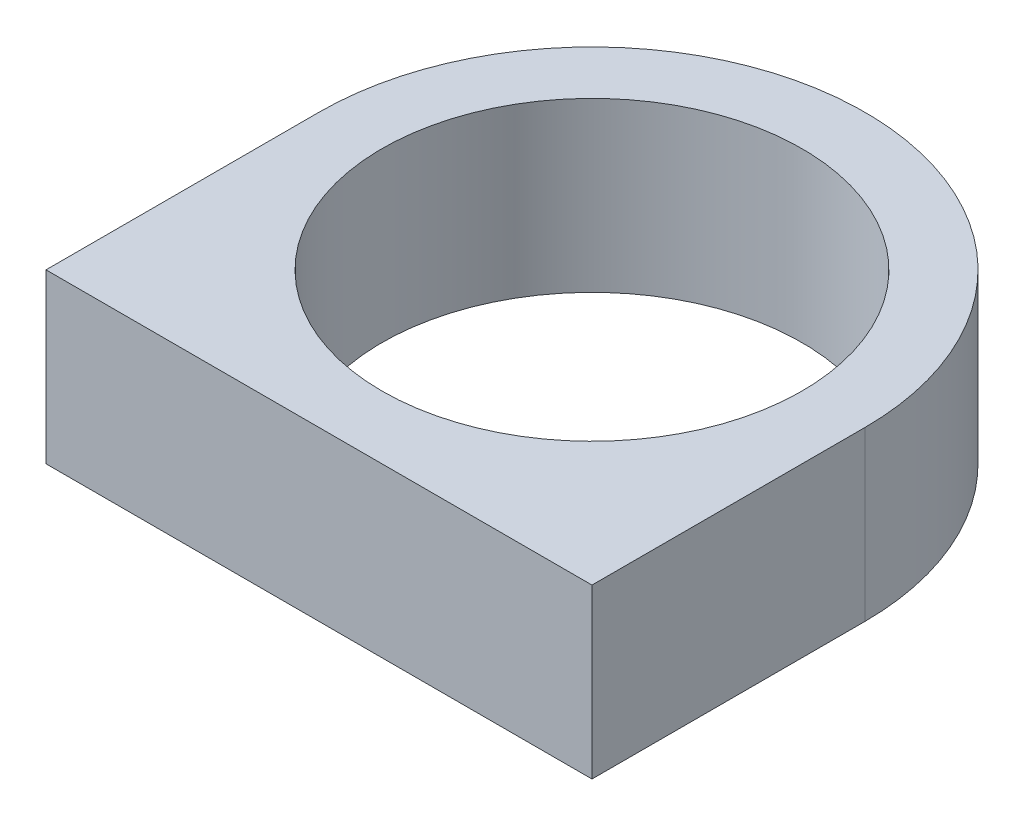
from build123d import *

# Parameters (mm, degrees)
SKETCH1_R           = 2.5
BOSS_EXTRUDE1_DEPTH = 2


with BuildPart() as part:
    # Sketch1 → Boss-Extrude1 (new body)
    with BuildSketch(Plane(origin=(0, 0, 0), x_dir=(1, 0, 0), z_dir=(0, 1, 0))):
        with BuildLine():
            Line((-3.25, 0), (-3.25, -3.25))
            Line((-3.25, -3.25), (3.25, -3.25))
            Line((3.25, -3.25), (3.25, 0))
            ThreePointArc((3.25, 0), (0, 3.25), (-3.25, 0))
        make_face()
        with Locations(Location((0, 0, 0), (0, 0, 270))):
            Circle(SKETCH1_R, mode=Mode.SUBTRACT)
    extrude(amount=BOSS_EXTRUDE1_DEPTH)


solid = part.part
